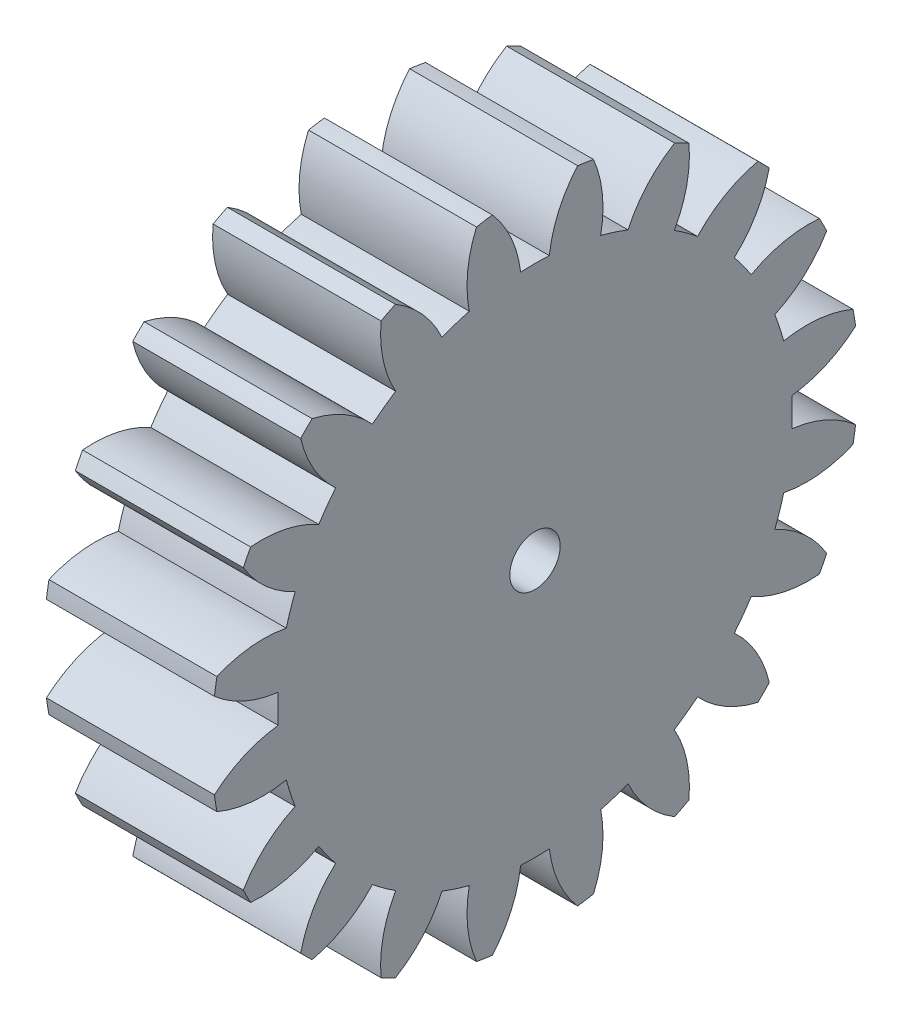
from build123d import *

# Parameters (mm, degrees)
BASPROSKE_W     = 10
BASPROSKE_H     = 19.25
TOOTHCUT_DEPTH  = 30.002155092
TEETHCUTS_COUNT = 20
TEETHCUTS_ANGLE = 342
BORSKE_R        = 1.5
BORE_DEPTH      = 50.0000508


with BuildPart() as part:
    # BasProSke → Base-Revolve (revolve)
    with BuildSketch(Plane(origin=(0, 0, 0), x_dir=(1, 0, 0), z_dir=(0, 1, 0)), mode=Mode.PRIVATE) as base_revolve_sk:
        with Locations((5, 9.625)):
            Rectangle(BASPROSKE_W, BASPROSKE_H)
    revolve(base_revolve_sk.sketch.rotate(Axis((-10, 0, 0), (1, 0, 0)), 180), axis=Axis((-10, 0, 0), (1, 0, 0)))

    # TooCutSke → ToothCut (cut, through all)
    with BuildSketch(Plane(origin=(0, 0, 0), x_dir=(0, 0, -1), z_dir=(1, 0, 0))):
        with BuildLine():
            ThreePointArc((0.85426341, 15.287650777), (0, 15.3115), (-0.85426341, 15.287650777))
            ThreePointArc((-0.85426341, 15.287650777), (-1.414533498, 17.326428412), (-2.557997552, 19.104912815))
            ThreePointArc((-2.557997552, 19.104912815), (0, 19.2754), (2.557997552, 19.104912815))
            ThreePointArc((2.557997552, 19.104912815), (1.414533498, 17.326428412), (0.85426341, 15.287650777))
        make_face()
    toothcut = extrude(amount=TOOTHCUT_DEPTH, mode=Mode.SUBTRACT)

    # TeethCuts: ToothCut ×20 about axis
    teethcuts_axis = Axis((-10, 0, 0), (1, 0, 0))
    for i in range(1, TEETHCUTS_COUNT):
        add(toothcut.rotate(teethcuts_axis, i * TEETHCUTS_ANGLE / (TEETHCUTS_COUNT - 1)), mode=Mode.SUBTRACT)

    # BorSke → Bore (cut, symmetric)
    with BuildSketch(Plane(origin=(0, 0, 0), x_dir=(0, 0, -1), z_dir=(1, 0, 0))):
        with Locations(Location((0, 0, 0), (0, 0, 180))):
            Circle(BORSKE_R)
    extrude(amount=BORE_DEPTH, both=True, mode=Mode.SUBTRACT)


solid = part.part
